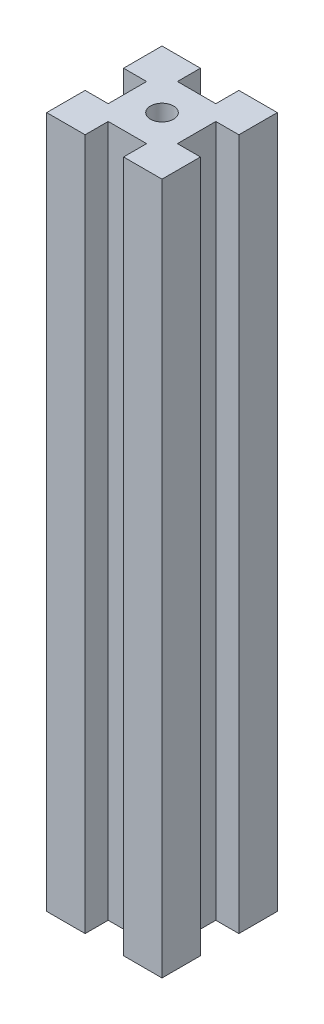
from build123d import *

# Parameters (mm, degrees)
SKETCH1_R           = 1.5
BOSS_EXTRUDE1_DEPTH = 90


with BuildPart() as part:
    # Sketch1 → Boss-Extrude1 (new body)
    with BuildSketch(Plane(origin=(0, 0, 0), x_dir=(1, 0, 0), z_dir=(0, 1, 0))):
        Polygon((2.5, 4.5), (-2.5, 4.5), (-2.5, 7.5), (-7.5, 7.5), (-7.5, 2.5), (-4.5, 2.5), (-4.5, -2.5), (-7.5, -2.5), (-7.5, -7.5), (-2.5, -7.5), (-2.5, -4.5), (2.5, -4.5), (2.5, -7.5), (7.5, -7.5), (7.5, -2.5), (4.5, -2.5), (4.5, 2.5), (7.5, 2.5), (7.5, 7.5), (2.5, 7.5), align=None)
        with Locations(Location((0, 0, 0), (0, 0, 90))):
            Circle(SKETCH1_R, mode=Mode.SUBTRACT)
    extrude(amount=BOSS_EXTRUDE1_DEPTH)


solid = part.part
